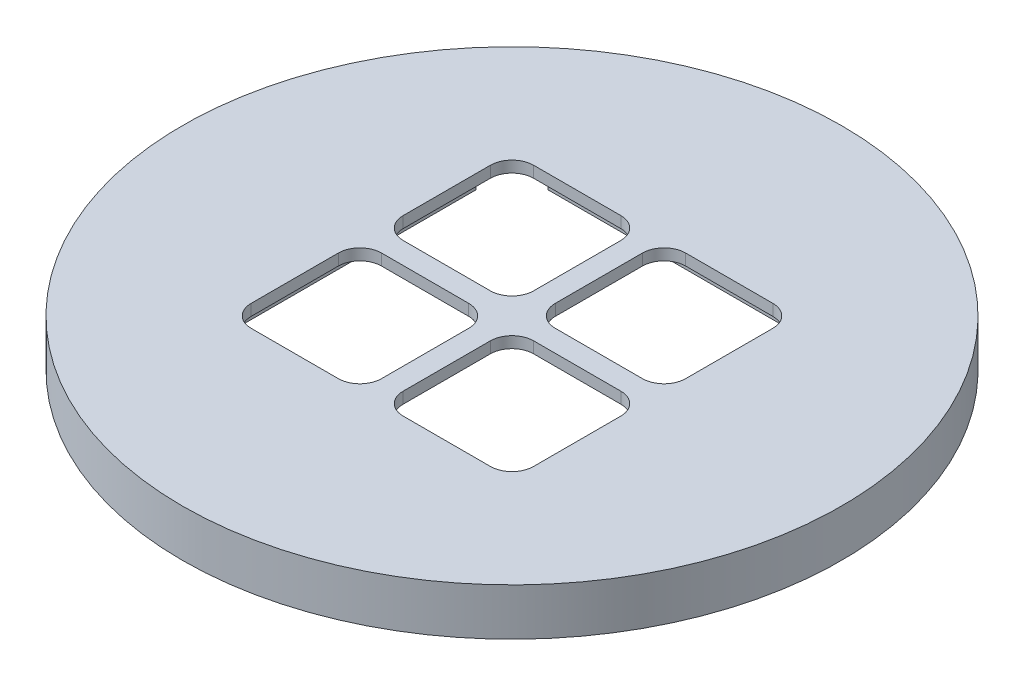
from build123d import *

# Parameters (mm, degrees)
SKETCH2_R           = 17.5
SKETCH2_W           = 18.5
SKETCH2_H           = 18.5
BOSS_EXTRUDE1_DEPTH = 2.5
SKETCH4_R           = 1.67
CUT_EXTRUDE1_DEPTH  = 1.15
CIRPATTERN1_COUNT   = 4
SKETCH5_W           = 18.5
SKETCH5_H           = 18.5
SKETCH5_W_2         = 15
SKETCH5_H_2         = 15
BOSS_EXTRUDE2_DEPTH = 0.6
SKETCH10_W          = 1.15
SKETCH10_H          = 6.925
SKETCH10_H_2        = 1.15
SKETCH10_W_2        = 6.925
BOSS_EXTRUDE4_DEPTH = 0.6
FILLET1_R           = 1.15
SKETCH11_R          = 1.5
CUT_EXTRUDE2_DEPTH  = 1.9
CIRPATTERN2_COUNT   = 4


with BuildPart() as part:
    # Sketch2 → Boss-Extrude1 (new body)
    with BuildSketch(Plane(origin=(0, 0, 0), x_dir=(1, 0, 0), z_dir=(0, 1, 0))):
        with Locations(Location((-21.383734207, -0.621346489, 0), (0, 0, 270))):
            Circle(SKETCH2_R)
        with Locations((-21.383734207, -0.621346489)):
            Rectangle(SKETCH2_W, SKETCH2_H, mode=Mode.SUBTRACT)
    extrude(amount=BOSS_EXTRUDE1_DEPTH)

    # Sketch4 → Cut-Extrude1 (cut)
    with BuildSketch(Plane.XZ):
        with Locations(Location((-21.569675845, 15.589648339, 0), (0, 0, 270))):
            Circle(SKETCH4_R)
    cut_extrude1 = extrude(amount=-CUT_EXTRUDE1_DEPTH, mode=Mode.SUBTRACT)

    # CirPattern1: Cut-Extrude1 ×4 about axis
    cirpattern1_axis = Axis((-21.383734207, 0, 0.621346489), (0, 1, 0))
    for i in range(1, CIRPATTERN1_COUNT):
        add(cut_extrude1.rotate(cirpattern1_axis, i * 360 / CIRPATTERN1_COUNT), mode=Mode.SUBTRACT)

    # Sketch5 → Boss-Extrude2 (add)
    with BuildSketch(Plane(origin=(0, 2.5, 0), x_dir=(1, 0, 0), z_dir=(0, 1, 0))):
        with Locations((-21.383734207, -0.621346489)):
            Rectangle(SKETCH5_W, SKETCH5_H)
        with Locations((-21.383734207, -0.621346489)):
            Rectangle(SKETCH5_W_2, SKETCH5_H_2, mode=Mode.SUBTRACT)
    extrude(amount=-BOSS_EXTRUDE2_DEPTH)

    # Sketch10 → Boss-Extrude4 (add)
    with BuildSketch(Plane(origin=(0, 2.5, 0), x_dir=(1, 0, 0), z_dir=(0, 1, 0))):
        with Locations((-21.383734207, 3.416153511)):
            Rectangle(SKETCH10_W, SKETCH10_H)
        with Locations((-21.383734207, -4.658846489)):
            Rectangle(SKETCH10_W, SKETCH10_H)
        with Locations((-21.383734207, -0.621346489)):
            Rectangle(SKETCH10_W, SKETCH10_H_2)
        with Locations((-17.346234207, -0.621346489)):
            Rectangle(SKETCH10_W_2, SKETCH10_H_2)
        with Locations((-25.421234207, -0.621346489)):
            Rectangle(SKETCH10_W_2, SKETCH10_H_2)
    extrude(amount=-BOSS_EXTRUDE4_DEPTH)

    # Fillet1
    fillet1_edges = [part.edges().sort_by_distance(p)[0] for p in [
        (-28.883734207, 2.2, -6.878653511),
        (-28.883734207, 2.2, 8.121346489),
        (-13.883734207, 2.2, 8.121346489),
        (-13.883734207, 2.2, -6.878653511),
        (-28.883734207, 2.2, 0.046346489),
        (-28.883734207, 2.2, 1.196346489),
        (-21.958734207, 2.2, 1.196346489),
        (-21.958734207, 2.2, 8.121346489),
        (-20.808734207, 2.2, 8.121346489),
        (-20.808734207, 2.2, 1.196346489),
        (-13.883734207, 2.2, 1.196346489),
        (-13.883734207, 2.2, 0.046346489),
        (-20.808734207, 2.2, 0.046346489),
        (-20.808734207, 2.2, -6.878653511),
        (-21.958734207, 2.2, -6.878653511),
        (-21.958734207, 2.2, 0.046346489),
    ]]
    fillet(fillet1_edges, radius=FILLET1_R)

    # Sketch11 → Cut-Extrude2 (cut)
    with BuildSketch(Plane.XZ):
        with Locations((-30.133734207, 9.371346489)):
            Circle(SKETCH11_R)
    cut_extrude2 = extrude(amount=-CUT_EXTRUDE2_DEPTH, mode=Mode.SUBTRACT)

    # CirPattern2: Cut-Extrude2 ×4 about axis
    cirpattern2_axis = Axis((-21.383734207, 0, 0.621346489), (0, 1, 0))
    for i in range(1, CIRPATTERN2_COUNT):
        add(cut_extrude2.rotate(cirpattern2_axis, i * 360 / CIRPATTERN2_COUNT), mode=Mode.SUBTRACT)


solid = part.part
